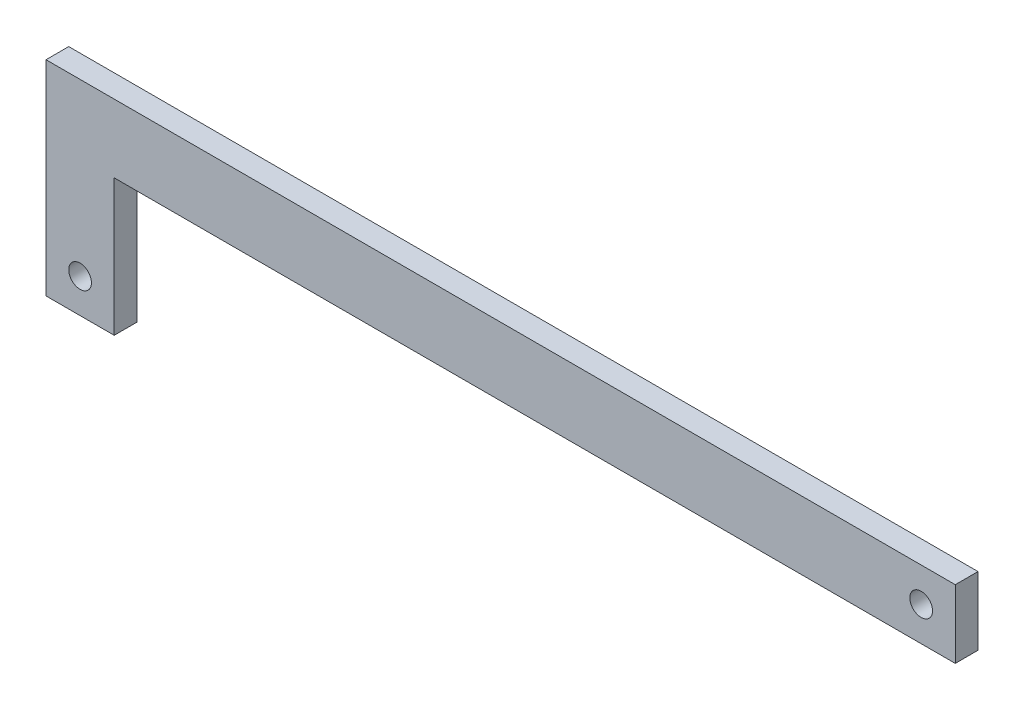
from build123d import *

# Parameters (mm, degrees)
SKETCH1_W           = 254
SKETCH1_H           = 19.05
SKETCH1_R           = 3.175
SKETCH1_W_2         = 19.05
SKETCH1_H_2         = 38.1
BOSS_EXTRUDE1_DEPTH = 6.35


with BuildPart() as part:
    # Sketch1 → Boss-Extrude1 (new body)
    # profile 1 of 2: a face of its own
    with BuildSketch(Plane.XY):
        with Locations((127, 9.525)):
            Rectangle(SKETCH1_W, SKETCH1_H)
        with Locations((244.475, 9.525)):
            Circle(SKETCH1_R, mode=Mode.SUBTRACT)
    # profile 2 of 2: a face of its own
    with BuildSketch(Plane.XY):
        with Locations((9.525, -19.05)):
            Rectangle(SKETCH1_W_2, SKETCH1_H_2)
        with Locations((9.525, -28.575)):
            Circle(SKETCH1_R, mode=Mode.SUBTRACT)
    extrude(amount=BOSS_EXTRUDE1_DEPTH)


solid = part.part
